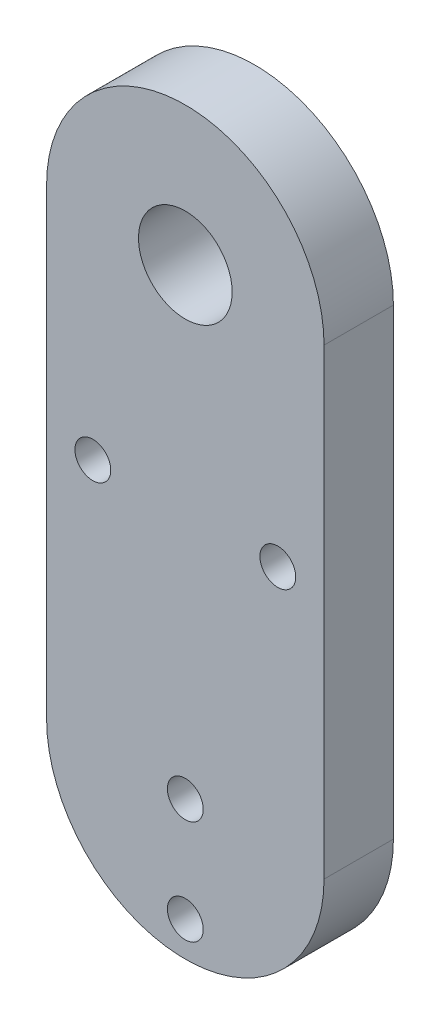
from build123d import *

# Parameters (mm, degrees)
DODANIE_WYCI_GNI_CIE1_DEPTH = 6
SZKIC2_R                    = 1.55
WYTNIJ_WYCI_GNI_CIE1_DEPTH  = 6
SZKIC5_R                    = 4.05
WYTNIJ_WYCI_GNI_CIE3_DEPTH  = 6
SZKIC7_R                    = 1.55
WYTNIJ_WYCI_GNI_CIE5_DEPTH  = 10


with BuildPart() as part:
    # Szkic1 → Dodanie-wyciągnięcie1 (new body)
    with BuildSketch(Plane.XY):
        with BuildLine():
            Line((-200.181077779, 116.924844228), (-200.181077779, 76.924846477))
            ThreePointArc((-200.181077779, 76.924846477), (-188.181077779, 64.924846477), (-176.181077779, 76.924846477))
            Line((-176.181077779, 76.924846477), (-176.181077779, 116.924844163))
            ThreePointArc((-176.181077779, 116.924844163), (-188.181077747, 128.924846477), (-200.181077779, 116.924844228))
        make_face()
    extrude(amount=DODANIE_WYCI_GNI_CIE1_DEPTH)

    # Szkic2 → Wytnij-wyciągnięcie1 (cut)
    with BuildSketch(Plane.XY.offset(6)):
        with Locations((-196.181077779, 98.324819795)):
            Circle(SZKIC2_R)
        with Locations((-180.181077779, 98.324819795)):
            Circle(SZKIC2_R)
        with Locations((-188.181077779, 67.924846477)):
            Circle(SZKIC2_R)
    extrude(amount=-WYTNIJ_WYCI_GNI_CIE1_DEPTH, mode=Mode.SUBTRACT)

    # Szkic5 → Wytnij-wyciągnięcie3 (cut)
    with BuildSketch(Plane.XY.offset(6)):
        with Locations((-188.181077779, 116.924846477)):
            Circle(SZKIC5_R)
    extrude(amount=-WYTNIJ_WYCI_GNI_CIE3_DEPTH, mode=Mode.SUBTRACT)

    # Szkic7 → Wytnij-wyciągnięcie5 (cut)
    with BuildSketch(Plane.XY.offset(6)):
        with Locations((-188.181077779, 76.924846477)):
            Circle(SZKIC7_R)
    extrude(amount=-WYTNIJ_WYCI_GNI_CIE5_DEPTH, mode=Mode.SUBTRACT)


solid = part.part
